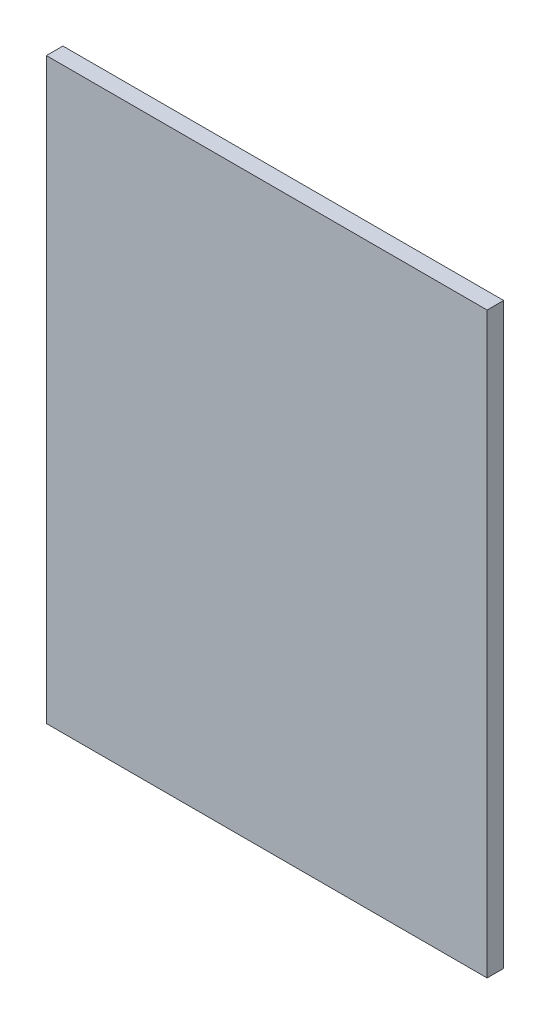
from build123d import *

# Parameters (mm, degrees)
SKETCH_1_W      = 80
SKETCH_1_H      = 105
EXTRUDE_1_DEPTH = 3


with BuildPart() as part:
    # 스케치1 → 보스-돌출1 (new body)
    with BuildSketch(Plane.XY):
        Rectangle(SKETCH_1_W, SKETCH_1_H)
    extrude(amount=EXTRUDE_1_DEPTH)


solid = part.part
